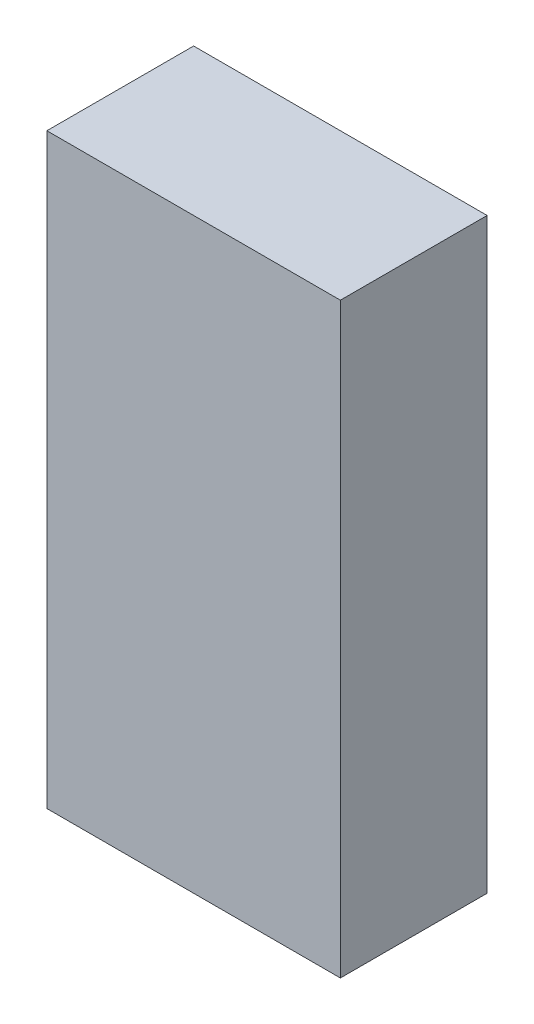
from build123d import *

# Parameters (mm, degrees)
SKETCH_1_W      = 20
SKETCH_1_H      = 40
EXTRUDE_1_DEPTH = 10


with BuildPart() as part:
    # 스케치1 → 보스-돌출1 (new body)
    with BuildSketch(Plane.XY):
        with Locations((23.370501893, 0)):
            Rectangle(SKETCH_1_W, SKETCH_1_H)
    extrude(amount=EXTRUDE_1_DEPTH)


solid = part.part
